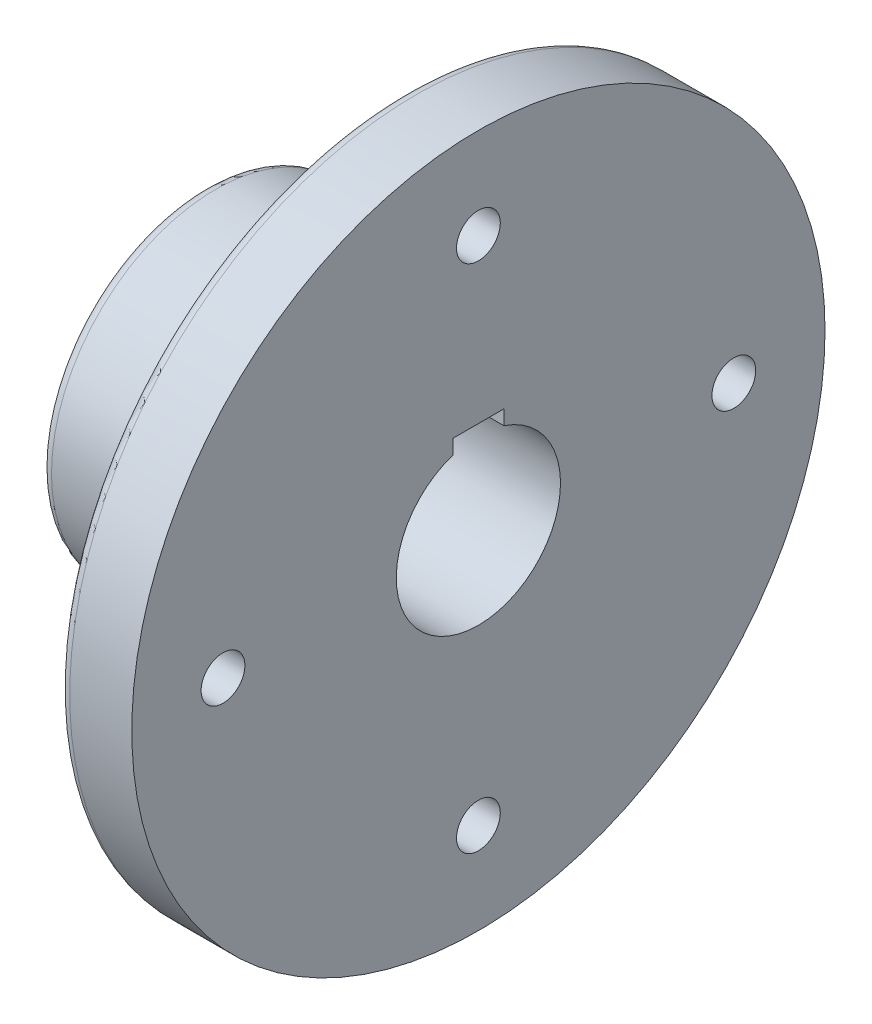
from build123d import *

# Parameters (mm, degrees)
SKETCH1_R           = 95
BOSS_EXTRUDE1_DEPTH = 20
SKETCH2_R           = 45
BOSS_EXTRUDE2_DEPTH = 55
SKETCH4_R           = 22.5
CUT_EXTRUDE1_DEPTH  = 75
SKETCH5_R           = 6
CUT_EXTRUDE2_DEPTH  = 20
SKETCH6_W           = 14
SKETCH6_H           = 4
CUT_EXTRUDE3_DEPTH  = 154.866825534
FILLET1_R           = 3


with BuildPart() as part:
    # Sketch1 → Boss-Extrude1 (new body)
    with BuildSketch(Plane(origin=(0, 0, 0), x_dir=(0, 0, -1), z_dir=(1, 0, 0))):
        Circle(SKETCH1_R)
    extrude(amount=-BOSS_EXTRUDE1_DEPTH)

    # Sketch2 → Boss-Extrude2 (add)
    with BuildSketch(Plane.ZY.offset(20)):
        Circle(SKETCH2_R)
    extrude(amount=BOSS_EXTRUDE2_DEPTH)

    # Sketch4 → Cut-Extrude1 (cut)
    with BuildSketch(Plane(origin=(0, 0, 0), x_dir=(0, 0, -1), z_dir=(1, 0, 0))):
        Circle(SKETCH4_R)
    extrude(amount=-CUT_EXTRUDE1_DEPTH, mode=Mode.SUBTRACT)

    # Sketch5 → Cut-Extrude2 (cut)
    with BuildSketch(Plane(origin=(0, 0, 0), x_dir=(0, 0, -1), z_dir=(1, 0, 0))):
        with Locations((0, 70)):
            Circle(SKETCH5_R)
        with Locations((70, 0)):
            Circle(SKETCH5_R)
        with Locations((0, -70)):
            Circle(SKETCH5_R)
        with Locations((-70, 0)):
            Circle(SKETCH5_R)
    extrude(amount=-CUT_EXTRUDE2_DEPTH, mode=Mode.SUBTRACT)

    # Sketch6 → Cut-Extrude3 (cut, through all)
    with BuildSketch(Plane(origin=(0, 0, 0), x_dir=(0, 0, -1), z_dir=(1, 0, 0))):
        with Locations((0, 23.38340478)):
            Rectangle(SKETCH6_W, SKETCH6_H)
    extrude(amount=-CUT_EXTRUDE3_DEPTH, mode=Mode.SUBTRACT)

    # Fillet1
    fillet1_edges = [part.edges().sort_by_distance(p)[0] for p in [
        (-20, 0, 95),
        (-20, 0, -45),
        (-75, 0, -45),
    ]]
    fillet(fillet1_edges, radius=FILLET1_R)


solid = part.part
